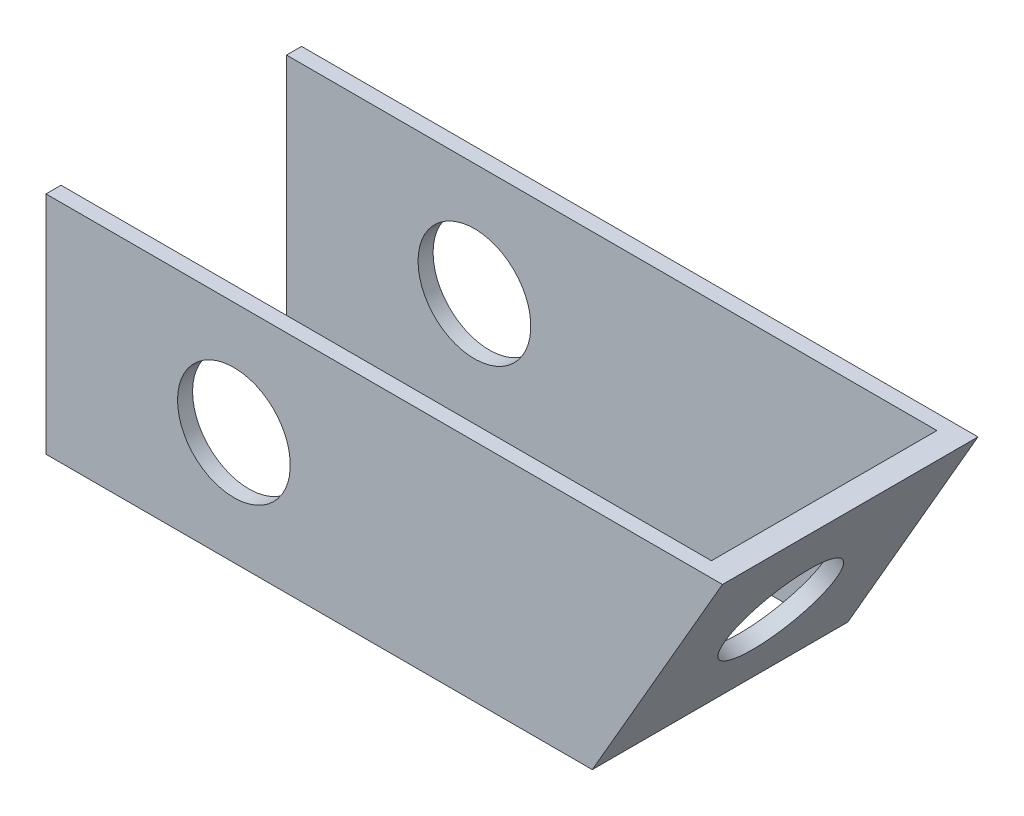
from build123d import *

# Parameters (mm, degrees)
RESSALTO_EXTRUS_O1_DEPTH = 34
CASCA1_T                 = -2
ESBO_O2_W                = 50
ESBO_O2_H                = 30
CORTE_EXTRUS_O1_DEPTH    = 50
ESBO_O3_R                = 7.5
CORTE_EXTRUS_O2_DEPTH    = 50
ESBO_O6_W                = 36.535898385
ESBO_O6_H                = 30
CORTE_EXTRUS_O5_DEPTH    = 2
ESBO_O7_W                = 21.524791386
ESBO_O7_H                = 30
CORTE_EXTRUS_O6_DEPTH    = 2
CORTE_EXTRUS_O7_DEPTH    = 2


with BuildPart() as part:
    # Esboço1 → Ressalto-extrusão1 (new body)
    with BuildSketch(Plane.XY):
        Polygon((27.679491924, -15), (45, 15), (-45, 15), (-45, -15), align=None)
    extrude(amount=RESSALTO_EXTRUS_O1_DEPTH)

    # Casca1
    casca1_openings = [part.faces().sort_by_distance(p)[0] for p in [
        (-45, 0, 17),
    ]]
    offset(amount=CASCA1_T, openings=casca1_openings, kind=Kind.INTERSECTION)

    # Esboço2 → Corte-extrusão1 (cut)
    with BuildSketch(Plane(origin=(0, 15, 0), x_dir=(1, 0, 0), z_dir=(0, 1, 0))):
        with Locations((-20, -17)):
            Rectangle(ESBO_O2_W, ESBO_O2_H)
    extrude(amount=-CORTE_EXTRUS_O1_DEPTH, mode=Mode.SUBTRACT)

    # Esboço3 → Corte-extrusão2 (cut)
    with BuildSketch(Plane(origin=(0, 0, 0), x_dir=(-1, 0, 0), z_dir=(0, 0, -1))):
        with Locations((20, 0)):
            Circle(ESBO_O3_R)
    extrude(amount=-CORTE_EXTRUS_O2_DEPTH, mode=Mode.SUBTRACT)

    # Esboço6 → Corte-extrusão5 (cut)
    with BuildSketch(Plane(origin=(0, 13, 0), x_dir=(-1, 0, 0), z_dir=(0, -1, 0))):
        with Locations((-23.267949193, -17)):
            Rectangle(ESBO_O6_W, ESBO_O6_H)
    extrude(amount=-CORTE_EXTRUS_O5_DEPTH, mode=Mode.SUBTRACT)

    # Esboço7 → Corte-extrusão6 (cut)
    with BuildSketch(Plane(origin=(0, -13, 0), x_dir=(1, 0, 0), z_dir=(0, 1, 0))):
        with Locations((15.762395693, -17)):
            Rectangle(ESBO_O7_W, ESBO_O7_H)
    extrude(amount=-CORTE_EXTRUS_O6_DEPTH, mode=Mode.SUBTRACT)

    # Esboço8 → Corte-extrusão7 (cut)
    with BuildSketch(Plane(origin=(25.522758664, -14.735571585, 0), x_dir=(0, 0, 1), z_dir=(-0.86602540378444, 0.49999999999999784, 0))):
        with BuildLine():
            ThreePointArc((24.5, 17.015172443), (22.303300859, 22.318473302), (17, 24.515172443))
            Line((17, 24.515172443), (17, 9.515172443))
            ThreePointArc((17, 9.515172443), (22.303300859, 11.711871584), (24.5, 17.015172443))
        make_face()
        with BuildLine():
            Line((17, 9.515172443), (17, 24.515172443))
            ThreePointArc((17, 24.515172443), (9.5, 17.015172443), (17, 9.515172443))
        make_face()
    extrude(amount=-CORTE_EXTRUS_O7_DEPTH, mode=Mode.SUBTRACT)


solid = part.part
